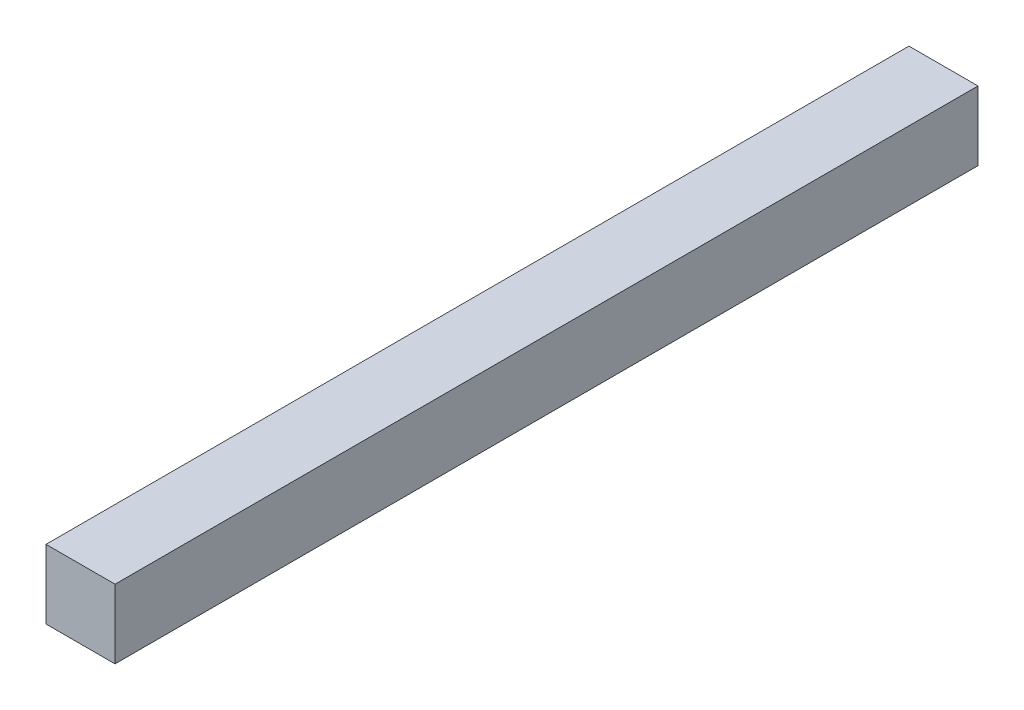
from build123d import *

# Parameters (mm, degrees)
SKETCH1_W           = 4.8
SKETCH1_H           = 4.8
BOSS_EXTRUDE1_DEPTH = 60


with BuildPart() as part:
    # Sketch1 → Boss-Extrude1 (new body)
    with BuildSketch(Plane.XY):
        Rectangle(SKETCH1_W, SKETCH1_H)
    extrude(amount=BOSS_EXTRUDE1_DEPTH)


solid = part.part
